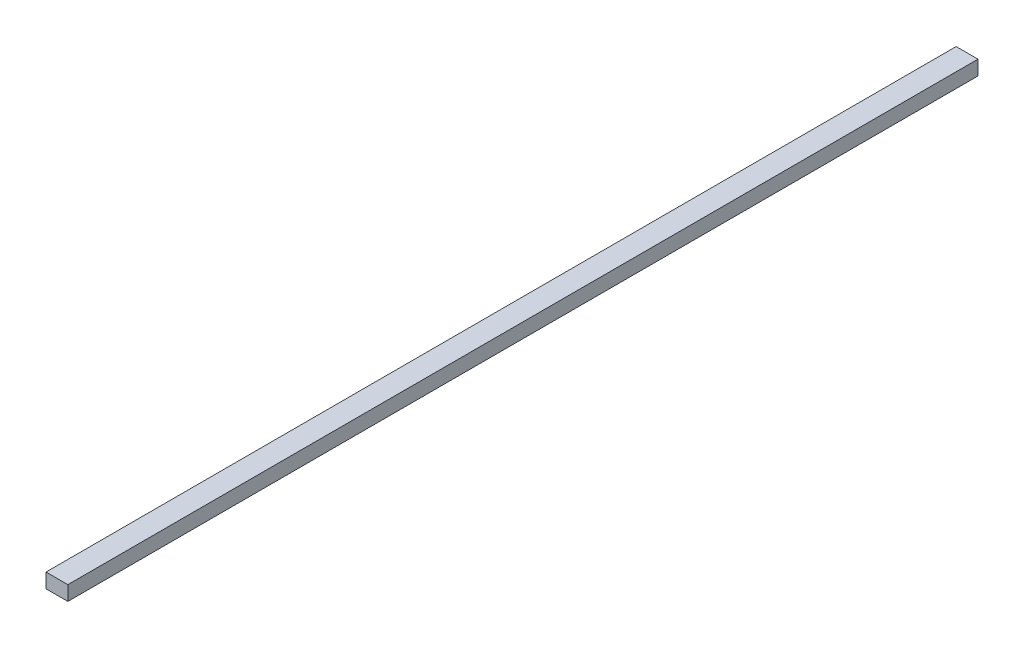
from build123d import *

# Parameters (mm, degrees)
SKETCH1_W           = 12
SKETCH1_H           = 500
BOSS_EXTRUDE1_DEPTH = 8


with BuildPart() as part:
    # Sketch1 → Boss-Extrude1 (new body)
    with BuildSketch(Plane(origin=(0, 0, 0), x_dir=(1, 0, 0), z_dir=(0, 1, 0))):
        with Locations((6, 250)):
            Rectangle(SKETCH1_W, SKETCH1_H)
    extrude(amount=BOSS_EXTRUDE1_DEPTH)


solid = part.part
